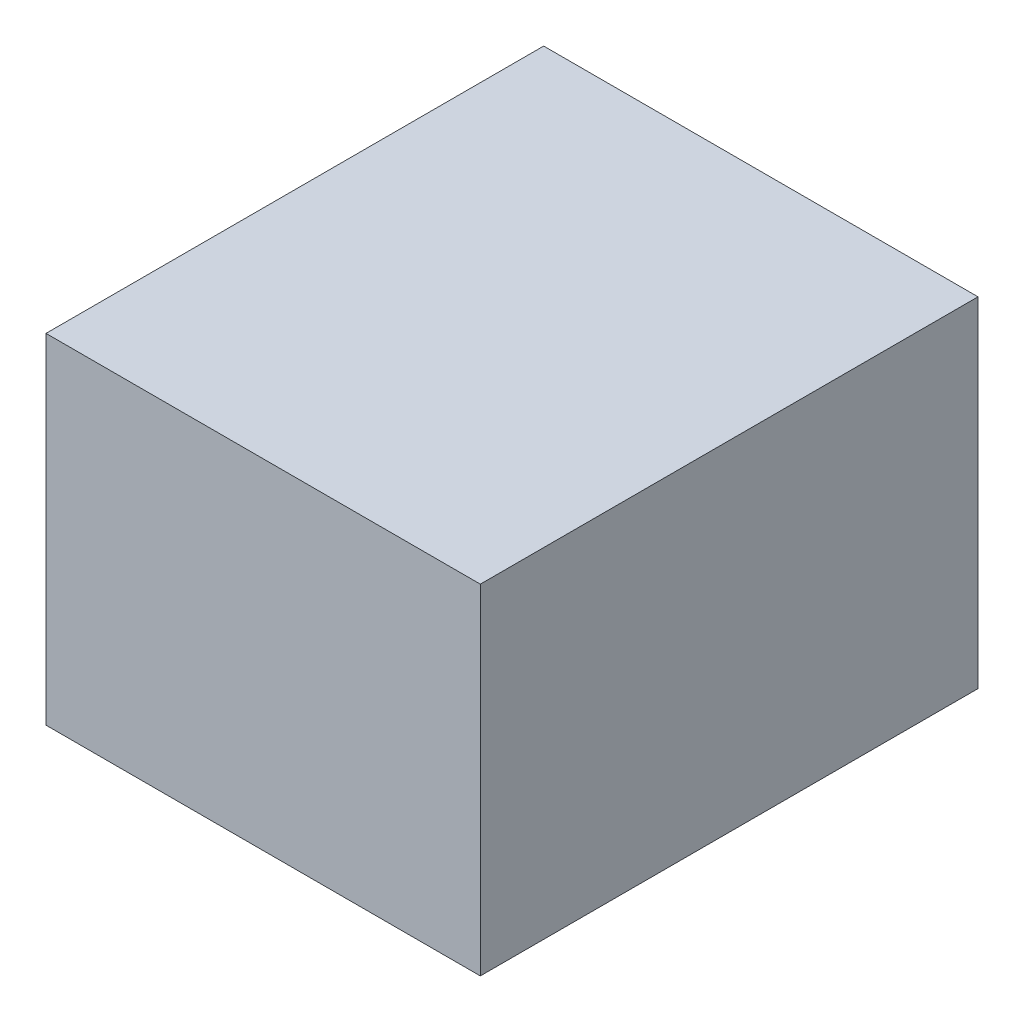
from build123d import *

# Parameters (mm, degrees)
SKETCH1_W           = 48
SKETCH1_H           = 55
BOSS_EXTRUDE1_DEPTH = 37.5


with BuildPart() as part:
    # Sketch1 → Boss-Extrude1 (new body)
    with BuildSketch(Plane(origin=(0, 0, 0), x_dir=(1, 0, 0), z_dir=(0, 1, 0))):
        Rectangle(SKETCH1_W, SKETCH1_H)
    extrude(amount=BOSS_EXTRUDE1_DEPTH)


solid = part.part
